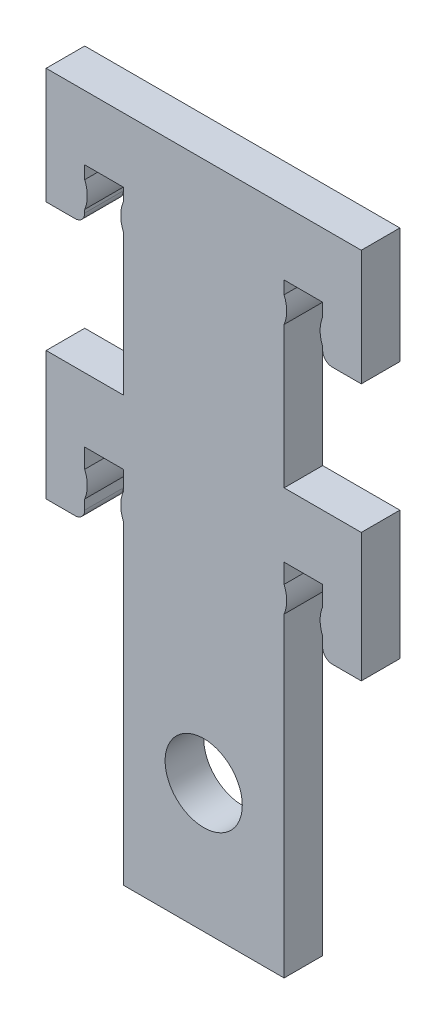
from build123d import *

# Parameters (mm, degrees)
SKETCH1_R           = 3
BOSS_EXTRUDE1_DEPTH = 3
FILLET3_R           = 0.75
FILLET4_R           = 0.75


with BuildPart() as part:
    # Sketch1 → Boss-Extrude1 (new body)
    with BuildSketch(Plane.XY):
        with BuildLine():
            Line((6, 12.755292895), (-18.5, 12.755292895))
            Line((-18.5, 12.755292895), (-18.5, 3.755292895))
            Line((-18.5, 3.755292895), (-15.5, 3.755292895))
            Line((-15.5, 3.755292895), (-15.5, 4.755292895))
            ThreePointArc((-15.5, 4.755292895), (-15.3, 5.755292895), (-15.5, 6.755292895))
            Line((-15.5, 6.755292895), (-15.5, 7.755292895))
            Line((-15.5, 7.755292895), (-12.5, 7.755292895))
            Line((-12.5, 7.755292895), (-12.5, 6.755292895))
            ThreePointArc((-12.5, 6.755292895), (-12.7, 5.755292895), (-12.5, 4.755292895))
            Line((-12.5, 4.755292895), (-12.5, -6.244707105))
            Line((-12.5, -6.244707105), (-18.5, -6.244707105))
            Line((-18.5, -6.244707105), (-18.5, -16.244707105))
            Line((-18.5, -16.244707105), (-15.5, -16.244707105))
            Line((-15.5, -16.244707105), (-15.5, -14.744707105))
            ThreePointArc((-15.5, -14.744707105), (-15.3, -13.744707105), (-15.5, -12.744707105))
            Line((-15.5, -12.744707105), (-15.5, -11.244707105))
            Line((-15.5, -11.244707105), (-12.5, -11.244707105))
            Line((-12.5, -11.244707105), (-12.5, -12.744707105))
            ThreePointArc((-12.5, -12.744707105), (-12.7, -13.744707105), (-12.5, -14.744707105))
            Line((-12.5, -14.744707105), (-12.5, -39.244707105))
            Line((-12.5, -39.244707105), (0, -39.244707105))
            Line((0, -39.244707105), (0, -14.744707105))
            ThreePointArc((0, -14.744707105), (0.2, -13.744707105), (0, -12.744707105))
            Line((0, -12.744707105), (0, -11.244707105))
            Line((0, -11.244707105), (3, -11.244707105))
            Line((3, -11.244707105), (3, -12.744707105))
            ThreePointArc((3, -12.744707105), (2.8, -13.744707105), (3, -14.744707105))
            Line((3, -14.744707105), (3, -16.244707105))
            Line((3, -16.244707105), (6, -16.244707105))
            Line((6, -16.244707105), (6, -6.244707105))
            Line((6, -6.244707105), (0, -6.244707105))
            Line((0, -6.244707105), (0, 4.755292895))
            ThreePointArc((0, 4.755292895), (0.2, 5.755292895), (0, 6.755292895))
            Line((0, 6.755292895), (0, 7.755292895))
            Line((0, 7.755292895), (3, 7.755292895))
            Line((3, 7.755292895), (3, 6.755292895))
            ThreePointArc((3, 6.755292895), (2.8, 5.755292895), (3, 4.755292895))
            Line((3, 4.755292895), (3, 3.755292895))
            Line((3, 3.755292895), (6, 3.755292895))
            Line((6, 3.755292895), (6, 12.755292895))
        make_face()
        with Locations((-6.25, -29.244707105)):
            Circle(SKETCH1_R, mode=Mode.SUBTRACT)
    extrude(amount=BOSS_EXTRUDE1_DEPTH)

    # Fillet3
    fillet3_edges = [part.edges().sort_by_distance(p)[0] for p in [
        (3, 3.755292895, 1.5),
    ]]
    fillet(fillet3_edges, radius=FILLET3_R)

    # Fillet4
    fillet4_edges = [part.edges().sort_by_distance(p)[0] for p in [
        (-15.5, 3.755292895, 1.5),
        (3, -16.244707105, 1.5),
        (-15.5, -16.244707105, 1.5),
    ]]
    fillet(fillet4_edges, radius=FILLET4_R)


solid = part.part
